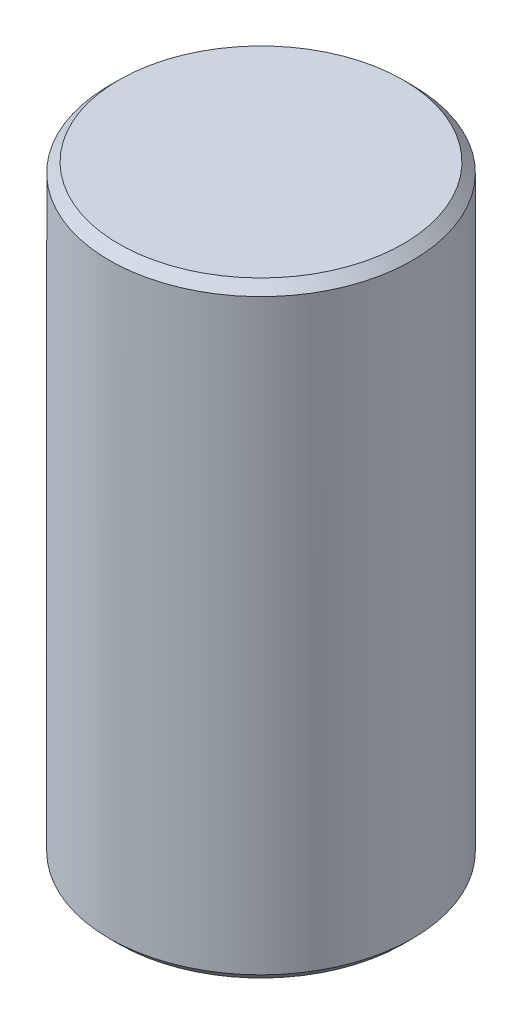
from build123d import *

# Parameters (mm, degrees)
SKETCH1_R           = 6.35
BOSS_EXTRUDE1_DEPTH = 25.4
CHAMFER1_SIZE       = 0.396875


with BuildPart() as part:
    # Sketch1 → Boss-Extrude1 (new body)
    with BuildSketch(Plane(origin=(0, 0, 0), x_dir=(1, 0, 0), z_dir=(0, 1, 0))):
        with Locations(Location((0, 0, 0), (0, 0, 270))):
            Circle(SKETCH1_R)
    extrude(amount=BOSS_EXTRUDE1_DEPTH)

    # Chamfer1
    chamfer1_edges = [part.edges().sort_by_distance(p)[0] for p in [
        (0, 0, -6.35),
        (0, 25.4, -6.35),
    ]]
    chamfer(chamfer1_edges, length=CHAMFER1_SIZE)


solid = part.part
